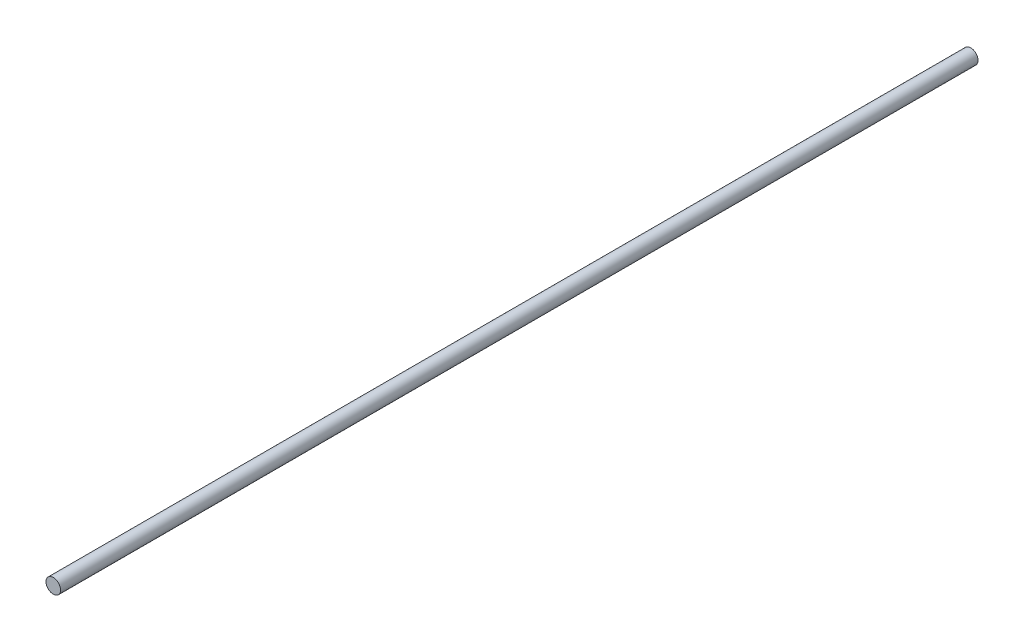
from build123d import *

# Parameters (mm, degrees)
SKETCH1_R           = 3.175
BOSS_EXTRUDE1_DEPTH = 200.025


with BuildPart() as part:
    # Sketch1 → Boss-Extrude1 (new, symmetric)
    with BuildSketch(Plane.XY):
        with Locations(Location((0, 0, 0), (0, 0, 180))):
            Circle(SKETCH1_R)
    extrude(amount=BOSS_EXTRUDE1_DEPTH, both=True)


solid = part.part
